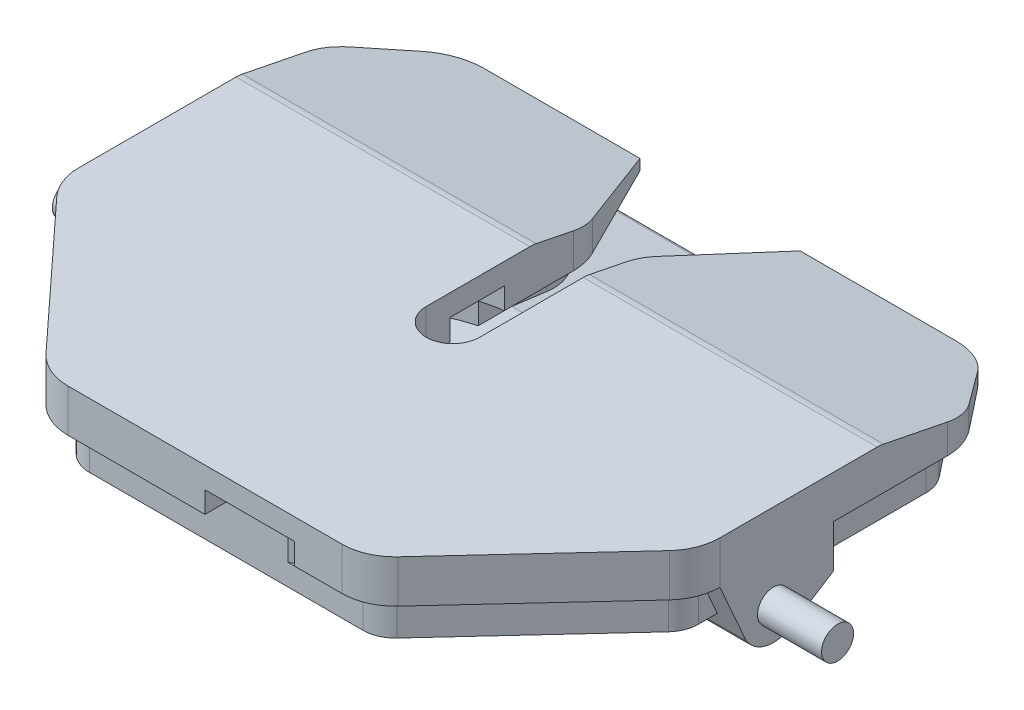
from build123d import *

# Parameters (mm, degrees)
BOSS_EXTRUDE1_DEPTH = 40
BOSS_EXTRUDE2_DEPTH = 40
CUT_EXTRUDE1_DEPTH  = 340
FILLET1_R           = 30
BOSS_EXTRUDE3_DEPTH = 165
FILLET2_R           = 5
BOSS_EXTRUDE4_START = -80
BOSS_EXTRUDE4_DEPTH = 100
BOSS_EXTRUDE5_DEPTH = 80
CUT_EXTRUDE2_DEPTH  = 20
CUT_EXTRUDE3_DEPTH  = 20
CUT_EXTRUDE4_DEPTH  = 10


with BuildPart() as part:
    # Sketch1 → Boss-Extrude1 (new body)
    with BuildSketch(Plane(origin=(0, 0, 0), x_dir=(1, 0, 0), z_dir=(0, 1, 0))):
        with BuildLine():
            Line((-25, 0), (-25, 137.726414563))
            ThreePointArc((-25, 137.726414563), (-26.389662789, 149.672244603), (-30.484431688, 160.980068695))
            Line((-30.484431688, 160.980068695), (-74.948974278, 250))
            Line((-74.948974278, 250), (-220.720785685, 250))
            ThreePointArc((-220.720785685, 250), (-242.524087913, 244.995733264), (-259.963008538, 230.984640477))
            Line((-259.963008538, 230.984640477), (-289.242222854, 193.902349528))
            ThreePointArc((-289.242222854, 193.902349528), (-297.234050973, 179.317234308), (-300, 162.917709051))
            Line((-300, 162.917709051), (-300, -50.165054409))
            ThreePointArc((-300, -50.165054409), (-296.564614821, -68.378693434), (-286.730534139, -84.089497837))
            Line((-286.730534139, -84.089497837), (-164.847437487, -216.05426395))
            ThreePointArc((-164.847437487, -216.05426395), (-148.164070588, -227.93496309), (-128.116903349, -232.129820522))
            Line((-128.116903349, -232.129820522), (128.116903349, -232.129820522))
            ThreePointArc((128.116903349, -232.129820522), (148.164070588, -227.93496309), (164.847437487, -216.05426395))
            Line((164.847437487, -216.05426395), (286.730534139, -84.089497837))
            ThreePointArc((286.730534139, -84.089497837), (296.564614821, -68.378693434), (300, -50.165054409))
            Line((300, -50.165054409), (300, 162.917709051))
            ThreePointArc((300, 162.917709051), (297.234050973, 179.317234308), (289.242222854, 193.902349528))
            Line((289.242222854, 193.902349528), (259.963008538, 230.984640477))
            ThreePointArc((259.963008538, 230.984640477), (242.524087913, 244.995733264), (220.720785685, 250))
            Line((220.720785685, 250), (74.948974278, 250))
            Line((74.948974278, 250), (30.484431688, 160.980068695))
            ThreePointArc((30.484431688, 160.980068695), (26.389662789, 149.672244603), (25, 137.726414563))
            Line((25, 137.726414563), (25, 0))
            ThreePointArc((25, 0), (0, -25), (-25, 0))
        make_face()
    extrude(amount=BOSS_EXTRUDE1_DEPTH)

    # Sketch1<4> → Boss-Extrude2 (add)
    with BuildSketch(Plane(origin=(0, 0, 0), x_dir=(1, 0, 0), z_dir=(0, 1, 0))):
        with BuildLine():
            Line((-50.484431688, 156.26301936), (-97.305092037, 250))
            Line((-97.305092037, 250), (-220.720785685, 250))
            Line((-220.720785685, 250), (-244.266119397, 218.590784286))
            Line((-244.266119397, 218.590784286), (-273.545333712, 181.508493337))
            ThreePointArc((-273.545333712, 181.508493337), (-278.340430584, 172.757424205), (-280, 162.917709051))
            Line((-280, 162.917709051), (-280, -50.165054409))
            ThreePointArc((-280, -50.165054409), (-277.938768893, -61.093237824), (-272.038320483, -70.519720466))
            Line((-272.038320483, -70.519720466), (-150.155223832, -202.484486579))
            ThreePointArc((-150.155223832, -202.484486579), (-140.145203692, -209.612906063), (-128.116903349, -212.129820522))
            Line((-128.116903349, -212.129820522), (128.116903349, -212.129820522))
            ThreePointArc((128.116903349, -212.129820522), (140.145203692, -209.612906063), (150.155223832, -202.484486579))
            Line((150.155223832, -202.484486579), (272.038320483, -70.519720466))
            ThreePointArc((272.038320483, -70.519720466), (277.938768893, -61.093237824), (280, -50.165054409))
            Line((280, -50.165054409), (280, 162.917709051))
            ThreePointArc((280, 162.917709051), (278.340430584, 172.757424205), (273.545333712, 181.508493337))
            Line((273.545333712, 181.508493337), (244.266119397, 218.590784286))
            Line((244.266119397, 218.590784286), (220.720785685, 250))
            Line((220.720785685, 250), (97.305092037, 250))
            Line((97.305092037, 250), (50.484431688, 156.26301936))
            ThreePointArc((50.484431688, 156.26301936), (46.389662789, 144.955195268), (45, 133.009365228))
            Line((45, 133.009365228), (45, 0))
            ThreePointArc((45, 0), (0, -45), (-45, 0))
            Line((-45, 0), (-45, 133.009365228))
            ThreePointArc((-45, 133.009365228), (-46.389662789, 144.955195268), (-50.484431688, 156.26301936))
        make_face()
    extrude(amount=-BOSS_EXTRUDE2_DEPTH)

    # Sketch2 → Cut-Extrude1 (cut, symmetric)
    with BuildSketch(Plane(origin=(0, 0, 0), x_dir=(0, 0, -1), z_dir=(1, 0, 0))):
        Polygon((100, 40), (250, 10), (250, 40), align=None)
    extrude(amount=CUT_EXTRUDE1_DEPTH, both=True, mode=Mode.SUBTRACT)

    # Fillet1
    fillet1_edges = [part.edges().sort_by_distance(p)[0] for p in [
        (162.5, 40, -100),
        (-162.5, 40, -100),
    ]]
    fillet(fillet1_edges, radius=FILLET1_R)

    # Sketch3 → Boss-Extrude3 (add, symmetric)
    with BuildSketch(Plane(origin=(0, 0, 0), x_dir=(0, 0, -1), z_dir=(1, 0, 0))):
        Polygon((-181.922721763, -20), (100, -20), (250, -40), (250, -50), (-50.165054409, -50), (-50.165054409, -40), (-181.922721763, -40), align=None)
    extrude(amount=BOSS_EXTRUDE3_DEPTH, both=True)

    # Fillet2
    fillet2_edges = [part.edges().sort_by_distance(p)[0] for p in [
        (0, -40, -250),
    ]]
    fillet(fillet2_edges, radius=FILLET2_R)

    # Sketch4 → Boss-Extrude4 (add)
    with BuildSketch(Plane(origin=(280, 0, 0), x_dir=(0, 0, -1), z_dir=(1, 0, 0)).offset(BOSS_EXTRUDE4_START)):
        with BuildLine():
            Line((15, -40), (56.376327321, -40))
            Line((56.376327321, -40), (56.376327321, 0))
            Line((56.376327321, 0), (-50.165054409, 0))
            Line((-50.165054409, 0), (-32.50986797, -40))
            Line((-32.50986797, -40), (-15, -40))
            ThreePointArc((-15, -40), (0, -25), (15, -40))
        make_face()
        with BuildLine():
            ThreePointArc((-25.62265212, -55.603836013), (-6.878338127, -69.200829862), (15.964147414, -65.399724356))
            Line((15.964147414, -65.399724356), (56.376327321, -40))
            Line((56.376327321, -40), (15, -40))
            ThreePointArc((15, -40), (0, -55), (-15, -40))
            Line((-15, -40), (-32.50986797, -40))
            Line((-32.50986797, -40), (-28.795547553, -48.41525051))
            Line((-28.795547553, -48.41525051), (-25.62265212, -55.603836013))
        make_face()
    boss_extrude4 = extrude(amount=BOSS_EXTRUDE4_DEPTH)

    # Sketch4<3> → Boss-Extrude5 (add)
    with BuildSketch(Plane(origin=(280, 0, 0), x_dir=(0, 0, -1), z_dir=(1, 0, 0))):
        with BuildLine():
            Line((-15, -40), (15, -40))
            ThreePointArc((15, -40), (0, -25), (-15, -40))
        make_face()
        with BuildLine():
            ThreePointArc((-15, -40), (0, -55), (15, -40))
            Line((15, -40), (-15, -40))
        make_face()
    boss_extrude5 = extrude(amount=BOSS_EXTRUDE5_DEPTH)

    # Mirror1: Boss-Extrude4, Boss-Extrude5 across plane
    add(boss_extrude4.mirror(Plane(origin=(0, 0, 0), x_dir=(0, 0, 1), z_dir=(1, 0, 0))))
    add(boss_extrude5.mirror(Plane(origin=(0, 0, 0), x_dir=(0, 0, 1), z_dir=(1, 0, 0))))

    # Sketch5 → Cut-Extrude2 (cut)
    with BuildSketch(Plane(origin=(0, -20, 0), x_dir=(1, 0, 0), z_dir=(0, 1, 0))):
        with BuildLine():
            ThreePointArc((-6.81e-07, 45), (22.828766792, 43.055805611), (45, 37.279220614))
            Line((45, 37.279220614), (45, 68.745078664))
            ThreePointArc((45, 68.745078664), (0, 75), (-45, 68.745078664))
            Line((-45, 68.745078664), (-45, 37.279220614))
            ThreePointArc((-45, 37.279220614), (-22.828767464, 43.055805496), (-6.81e-07, 45))
        make_face()
        with BuildLine():
            Line((-82.5, 52.894191624), (-67.5, 26.913429511))
            ThreePointArc((-67.5, 26.913429511), (-56.48827229, 32.613519213), (-45, 37.279220614))
            Line((-45, 37.279220614), (-45, 68.745078664))
            ThreePointArc((-45, 68.745078664), (-64.240759296, 61.980672604), (-82.5, 52.894191624))
        make_face()
        with BuildLine():
            ThreePointArc((45, 37.279220614), (124.484015856, -37.762754702), (122.35155125, -147.053465335))
            Line((122.35155125, -147.053465335), (149.540784861, -159.732013187))
            ThreePointArc((149.540784861, -159.732013187), (161.088841175, -125.7125363), (165, -90))
            ThreePointArc((165, -90), (131.624465811, 9.498743711), (45, 68.745078664))
            Line((45, 68.745078664), (45, 37.279220614))
        make_face()
        with BuildLine():
            ThreePointArc((122.35155125, -147.053465335), (72.535447127, -203.857845185), (0, -225))
            Line((0, -225), (0, -255))
            ThreePointArc((0, -255), (88.654435377, -229.159588559), (149.540784861, -159.732013187))
            Line((149.540784861, -159.732013187), (122.35155125, -147.053465335))
        make_face()
    extrude(amount=CUT_EXTRUDE2_DEPTH, mode=Mode.SUBTRACT)

    # Sketch6 → Cut-Extrude3 (cut)
    with BuildSketch(Plane.XZ):
        with BuildLine():
            ThreePointArc((7.7e-08, -25), (-12.57541279, -24.31036258), (-25, -22.249721603))
            Line((-25, -22.249721603), (-25, -73.095064303))
            ThreePointArc((-25, -73.095064303), (0, -75), (25, -73.095064303))
            Line((25, -73.095064303), (25, -22.249721603))
            ThreePointArc((25, -22.249721603), (12.575412867, -24.310362571), (7.7e-08, -25))
        make_face()
        with BuildLine():
            ThreePointArc((-45, -37.279220614), (-56.48827229, -32.613519213), (-67.5, -26.913429511))
            Line((-67.5, -26.913429511), (-82.5, -52.894191624))
            ThreePointArc((-82.5, -52.894191624), (-64.240759296, -61.980672604), (-45, -68.745078664))
            ThreePointArc((-45, -68.745078664), (-35.067514793, -71.23048535), (-25, -73.095064303))
            Line((-25, -73.095064303), (-25, -22.249721603))
            ThreePointArc((-25, -22.249721603), (-35.14687807, -19.497474683), (-45, -15.830052443))
            Line((-45, -15.830052443), (-45, -37.279220614))
        make_face()
        with BuildLine():
            Line((149.540784861, 159.732013187), (122.35155125, 147.053465335))
            ThreePointArc((122.35155125, 147.053465335), (124.484015856, 37.762754702), (45, -37.279220614))
            Line((45, -37.279220614), (45, -15.830052443))
            ThreePointArc((45, -15.830052443), (35.14687807, -19.497474683), (25, -22.249721603))
            Line((25, -22.249721603), (25, -73.095064303))
            ThreePointArc((25, -73.095064303), (35.067514793, -71.23048535), (45, -68.745078664))
            ThreePointArc((45, -68.745078664), (131.624465811, -9.498743711), (165, 90))
            ThreePointArc((165, 90), (161.088841175, 125.7125363), (149.540784861, 159.732013187))
        make_face()
        with BuildLine():
            ThreePointArc((57.526575939, 212.129820522), (95.64396563, 185.274507811), (122.35155125, 147.053465335))
            Line((122.35155125, 147.053465335), (149.540784861, 159.732013187))
            ThreePointArc((149.540784861, 159.732013187), (132.852908259, 187.852464288), (110.947316053, 212.129820522))
            ThreePointArc((110.947316053, 212.129820522), (97.890765079, 222.824689392), (83.809988178, 232.129820522))
            Line((83.809988178, 232.129820522), (0, 232.129820522))
            Line((0, 232.129820522), (0, 212.129820522))
            Line((0, 212.129820522), (57.526575939, 212.129820522))
        make_face()
        with BuildLine():
            ThreePointArc((0, 205), (61.78945496, 186.990016268), (104.225395509, 138.6011001))
            Line((104.225395509, 138.6011001), (122.35155125, 147.053465335))
            ThreePointArc((122.35155125, 147.053465335), (95.64396563, 185.274507811), (57.526575939, 212.129820522))
            Line((57.526575939, 212.129820522), (0, 212.129820522))
            Line((0, 212.129820522), (0, 205))
        make_face()
        with BuildLine():
            Line((122.35155125, 147.053465335), (104.225395509, 138.6011001))
            ThreePointArc((104.225395509, 138.6011001), (112.274040819, 114.890555603), (115, 90))
            ThreePointArc((115, 90), (95.916630466, 26.557112298), (45, -15.830052443))
            Line((45, -15.830052443), (45, -37.279220614))
            ThreePointArc((45, -37.279220614), (124.484015856, 37.762754702), (122.35155125, 147.053465335))
        make_face()
        with BuildLine():
            ThreePointArc((-45, -15.830052443), (-51.344794778, -12.901467673), (-57.5, -9.592921435))
            Line((-57.5, -9.592921435), (-67.5, -26.913429511))
            ThreePointArc((-67.5, -26.913429511), (-56.48827229, -32.613519213), (-45, -37.279220614))
            Line((-45, -37.279220614), (-45, -15.830052443))
        make_face()
        with BuildLine():
            Line((-83.809988178, 232.129820522), (0, 232.129820522))
            Line((0, 232.129820522), (0, 255))
            ThreePointArc((0, 255), (-43.43719382, 249.179804602), (-83.809988178, 232.129820522))
        make_face()
        with BuildLine():
            Line((0, 255), (0, 232.129820522))
            Line((0, 232.129820522), (83.809988178, 232.129820522))
            ThreePointArc((83.809988178, 232.129820522), (43.43719382, 249.179804602), (0, 255))
        make_face()
    extrude(amount=-CUT_EXTRUDE3_DEPTH, mode=Mode.SUBTRACT)

    # Sketch7 → Cut-Extrude4 (cut)
    with BuildSketch(Plane(origin=(0, 0, 0), x_dir=(1, 0, 0), z_dir=(0, 1, 0))):
        Polygon((300, -50.165054409), (163.677759593, -69.153153364), (68.370461669, -258.499505871), (208.609391352, -264.686517475), (324.100274621, -68.378693434), align=None)
    extrude(amount=-CUT_EXTRUDE4_DEPTH, mode=Mode.SUBTRACT)


solid = part.part
